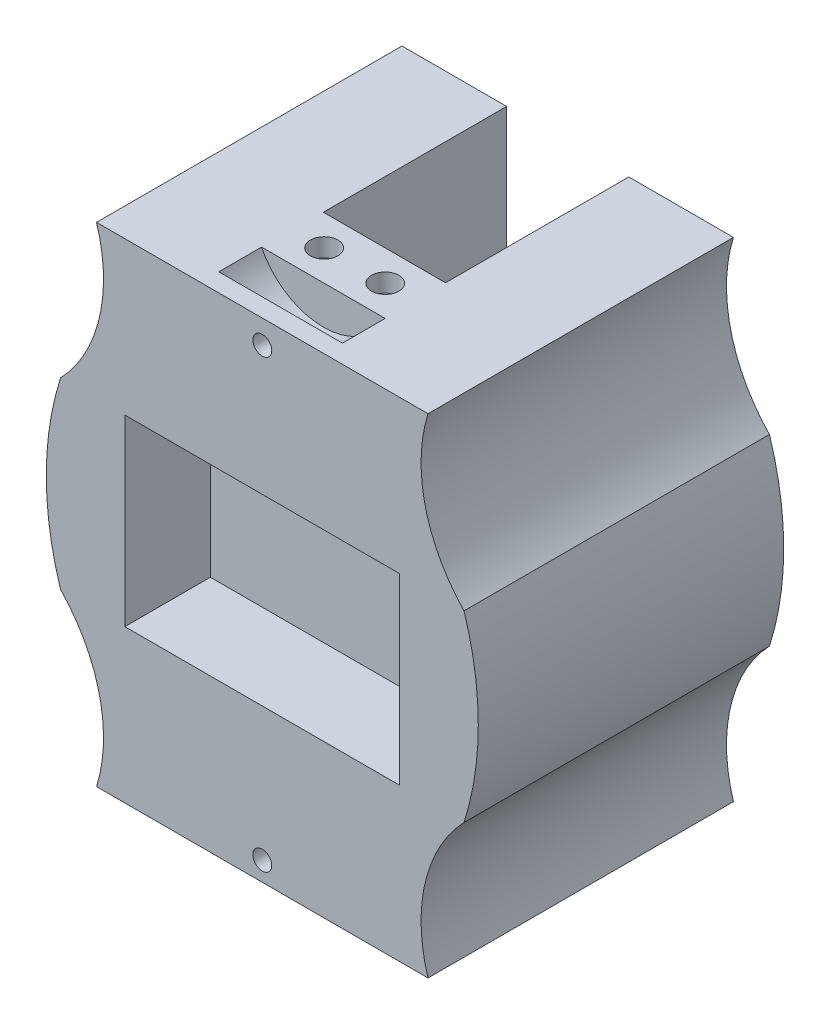
from build123d import *

# Parameters (mm, degrees)
SKETCH_1_W                = 65
SKETCH_1_H                = 25
SKETCH_1_W_2              = 17.5
SKETCH_1_H_2              = 30
EXTRUDE_1_DEPTH           = 30
SKETCH_2_W                = 37.5
SKETCH_2_H                = 30
EXTRUDE_2_DEPTH           = 10
CUT_EXTRUDE_2_DEPTH       = 10
SKETCH_4_W                = 45
SKETCH_4_H                = 30
CUT_EXTRUDE_3_DEPTH       = 6
CUT_EXTRUDE_13_DEPTH      = 16
EXTRUDE_3_DEPTH           = 3
CUT_EXTRUDE_14_DEPTH      = 3
SKETCH_8_R                = 1.55
CUT_EXTRUDE_16_DEPTH      = 6.100799321
CUT_EXTRUDE_17_DEPTH      = 70
EXTRUDE_4_DEPTH           = 20
SKETCH_19_W               = 20
SKETCH_19_H               = 60
CUT_EXTRUDE_25_DEPTH      = 26.5
SKETCH_21_R               = 2.25
CUT_EXTRUDE_27_DEPTH      = 3
SKETCH_22_R               = 2.25
CUT_EXTRUDE_28_DEPTH      = 3
SKETCH_23_W               = 20
SKETCH_23_H               = 26.5
CUT_EXTRUDE_29_DEPTH      = 30
CUT_EXTRUDE_START         = -3
SKETCH_24_R               = 2.25
CUT_EXTRUDE_30_DEPTH      = 3
SKETCH_25_R               = 2
EXTRUDE_5_DEPTH           = 6
SKETCH_26_W               = 45
SKETCH_26_H               = 30
CUT_EXTRUDE_31_DEPTH      = 8
CUT_EXTRUDE_33_DEPTH      = 13
CUT_EXTRUDE_33_DEPTH_BACK = 13
SKETCH_27_R               = 2


with BuildPart() as part:
    # 草图1 → 凸台-拉伸1 (new body)
    with BuildSketch(Plane.XY):
        with Locations((0, 27.5)):
            Rectangle(SKETCH_1_W, SKETCH_1_H)
        with BuildLine():
            ThreePointArc((-41.25, 40), (-40.44733047, 25.687815665), (-50, 15))
            Line((-50, 15), (-32.5, 15))
            Line((-32.5, 15), (-32.5, 40))
            Line((-32.5, 40), (-41.25, 40))
        make_face()
        with BuildLine():
            Line((32.5, 40), (32.5, 15))
            Line((32.5, 15), (50, 15))
            ThreePointArc((50, 15), (40.44733047, 25.687815665), (41.25, 40))
            Line((41.25, 40), (32.5, 40))
        make_face()
        with Locations((41.25, 0)):
            Rectangle(SKETCH_1_W_2, SKETCH_1_H_2)
        Rectangle(SKETCH_1_W, SKETCH_1_H_2)
        with Locations((-41.25, 0)):
            Rectangle(SKETCH_1_W_2, SKETCH_1_H_2)
        with BuildLine():
            ThreePointArc((-50, -15), (-40.44733047, -25.687815665), (-41.25, -40))
            Line((-41.25, -40), (-32.5, -40))
            Line((-32.5, -40), (-32.5, -15))
            Line((-32.5, -15), (-50, -15))
        make_face()
        with Locations((0, -27.5)):
            Rectangle(SKETCH_1_W, SKETCH_1_H)
        with BuildLine():
            Line((32.5, -15), (32.5, -40))
            Line((32.5, -40), (41.25, -40))
            ThreePointArc((41.25, -40), (40.44733047, -25.687815665), (50, -15))
            Line((50, -15), (32.5, -15))
        make_face()
    extrude(amount=EXTRUDE_1_DEPTH)

    # 草图2 → 凸台-拉伸2 (add)
    with BuildSketch(Plane.XY.offset(30)):
        with Locations((68.75, 0)):
            Rectangle(SKETCH_2_W, SKETCH_2_H)
        with BuildLine():
            ThreePointArc((31.362634986, 83.717731106), (24.230066028, 60.16346689), (10.119378388, 40))
            Line((10.119378388, 40), (41.25, 40))
            Line((41.25, 40), (56.546841385, 71.480257998))
            Line((56.546841385, 71.480257998), (31.362634986, 83.717731106))
        make_face()
        with BuildLine():
            Line((-56.546841385, 71.480257998), (-41.25, 40))
            Line((-41.25, 40), (-10.119378388, 40))
            ThreePointArc((-10.119378388, 40), (-24.230066028, 60.16346689), (-31.362634986, 83.717731106))
            Line((-31.362634986, 83.717731106), (-56.546841385, 71.480257998))
        make_face()
        with Locations((-68.75, 0)):
            Rectangle(SKETCH_2_W, SKETCH_2_H)
        with BuildLine():
            ThreePointArc((-31.362634986, -83.717731106), (-24.230066028, -60.16346689), (-10.119378388, -40))
            Line((-10.119378388, -40), (-41.25, -40))
            Line((-41.25, -40), (-56.546841385, -71.480257998))
            Line((-56.546841385, -71.480257998), (-31.362634986, -83.717731106))
        make_face()
        with BuildLine():
            Line((41.25, -40), (10.119378388, -40))
            ThreePointArc((10.119378388, -40), (24.230066028, -60.16346689), (31.362634986, -83.717731106))
            Line((31.362634986, -83.717731106), (56.546841385, -71.480257998))
            Line((56.546841385, -71.480257998), (41.25, -40))
        make_face()
    extrude(amount=-EXTRUDE_2_DEPTH)

    # 草图3 → 切除-拉伸2 (cut)
    with BuildSketch(Plane.XY.offset(30)):
        with BuildLine():
            ThreePointArc((-30.119378388, 40), (-30.215276688, 27.042312386), (-35, 15))
            Line((-35, 15), (-50, 15))
            ThreePointArc((-50, 15), (-40.44733047, 25.687815665), (-41.25, 40))
            Line((-41.25, 40), (-56.546841385, 71.480257998))
            Line((-56.546841385, 71.480257998), (-31.362634986, 83.717731106))
            ThreePointArc((-31.362634986, 83.717731106), (-24.230066028, 60.16346689), (-10.119378388, 40))
            Line((-10.119378388, 40), (-30.119378388, 40))
        make_face()
        with BuildLine():
            Line((10.119378388, 40), (30.119378388, 40))
            ThreePointArc((30.119378388, 40), (30.215276688, 27.042312386), (35, 15))
            Line((35, 15), (50, 15))
            ThreePointArc((50, 15), (40.44733047, 25.687815665), (41.25, 40))
            Line((41.25, 40), (56.546841385, 71.480257998))
            Line((56.546841385, 71.480257998), (31.362634986, 83.717731106))
            ThreePointArc((31.362634986, 83.717731106), (24.230066028, 60.16346689), (10.119378388, 40))
        make_face()
        with BuildLine():
            Line((50, 15), (35, 15))
            ThreePointArc((35, 15), (38.436125858, 0), (35, -15))
            ThreePointArc((35, -15), (30.215276688, -27.042312386), (30.119378388, -40))
            Line((30.119378388, -40), (10.119378388, -40))
            ThreePointArc((10.119378388, -40), (24.230066028, -60.16346689), (31.362634986, -83.717731106))
            Line((31.362634986, -83.717731106), (56.546841385, -71.480257998))
            Line((56.546841385, -71.480257998), (41.25, -40))
            ThreePointArc((41.25, -40), (40.44733047, -25.687815665), (50, -15))
            Line((50, -15), (87.5, -15))
            Line((87.5, -15), (87.5, 15))
            Line((87.5, 15), (50, 15))
        make_face()
        with BuildLine():
            ThreePointArc((-35, 15), (-38.436125858, 0), (-35, -15))
            ThreePointArc((-35, -15), (-30.215276688, -27.042312386), (-30.119378388, -40))
            Line((-30.119378388, -40), (-10.119378388, -40))
            ThreePointArc((-10.119378388, -40), (-24.230066028, -60.16346689), (-31.362634986, -83.717731106))
            Line((-31.362634986, -83.717731106), (-56.546841385, -71.480257998))
            Line((-56.546841385, -71.480257998), (-41.25, -40))
            ThreePointArc((-41.25, -40), (-40.44733047, -25.687815665), (-50, -15))
            Line((-50, -15), (-87.5, -15))
            Line((-87.5, -15), (-87.5, 15))
            Line((-87.5, 15), (-50, 15))
            Line((-50, 15), (-35, 15))
        make_face()
        with BuildLine():
            ThreePointArc((-10.119378388, 40), (0, 33.708220629), (10.119378388, 40))
            Line((10.119378388, 40), (-10.119378388, 40))
        make_face()
        with BuildLine():
            ThreePointArc((-10.119378388, -40), (0, -33.708220629), (10.119378388, -40))
            Line((10.119378388, -40), (-10.119378388, -40))
        make_face()
    extrude(amount=-CUT_EXTRUDE_2_DEPTH, mode=Mode.SUBTRACT)

    # 草图4 → 切除-拉伸3 (cut)
    with BuildSketch(Plane.XY.offset(30)):
        Rectangle(SKETCH_4_W, SKETCH_4_H)
    extrude(amount=-CUT_EXTRUDE_3_DEPTH, mode=Mode.SUBTRACT)

    # 草图5 → 切除-拉伸13 (cut)
    with BuildSketch(Plane.XY.offset(30)):
        with BuildLine():
            ThreePointArc((-30.119378388, 40), (-30.215276688, 27.042312386), (-35, 15))
            ThreePointArc((-35, 15), (-38.436125858, 0), (-35, -15))
            ThreePointArc((-35, -15), (-30.215276688, -27.042312386), (-30.119378388, -40))
            Line((-30.119378388, -40), (-27.133662439, -40))
            ThreePointArc((-27.133662439, -40), (-26.666769997, -26.695264692), (-33.027175168, -15))
            ThreePointArc((-33.027175168, -15), (-35.361355844, 0), (-33.027175168, 15))
            ThreePointArc((-33.027175168, 15), (-26.666769997, 26.695264692), (-27.133662439, 40))
            Line((-27.133662439, 40), (-30.119378388, 40))
        make_face()
        with BuildLine():
            Line((30.119378388, 40), (27.133662439, 40))
            ThreePointArc((27.133662439, 40), (26.666769997, 26.695264692), (33.027175168, 15))
            ThreePointArc((33.027175168, 15), (35.361355844, 0), (33.027175168, -15))
            ThreePointArc((33.027175168, -15), (26.666769997, -26.695264692), (27.133662439, -40))
            Line((27.133662439, -40), (30.119378388, -40))
            ThreePointArc((30.119378388, -40), (30.215276688, -27.042312386), (35, -15))
            ThreePointArc((35, -15), (38.436125858, 0), (35, 15))
            ThreePointArc((35, 15), (30.215276688, 27.042312386), (30.119378388, 40))
        make_face()
    extrude(amount=-CUT_EXTRUDE_13_DEPTH, mode=Mode.SUBTRACT)

    # 草图6 → 凸台-拉伸3 (add)
    with BuildSketch(Plane.XY.offset(30)):
        with BuildLine():
            Line((-10.119378388, 40), (10.119378388, 40))
            ThreePointArc((10.119378388, 40), (0, 33.708220629), (-10.119378388, 40))
        make_face()
        with BuildLine():
            Line((-10.119378388, -40), (10.119378388, -40))
            ThreePointArc((10.119378388, -40), (0, -33.708220629), (-10.119378388, -40))
        make_face()
    extrude(amount=-EXTRUDE_3_DEPTH)

    # 草图7 → 切除-拉伸14 (cut)
    with BuildSketch(Plane(origin=(0, 0, 27), x_dir=(-1, 0, 0), z_dir=(0, 0, -1))):
        with BuildLine():
            ThreePointArc((0, -35.304110315), (-1.55, -36.854110315), (0, -38.404110315))
            Line((0, -38.404110315), (0, -36.854110315))
            Line((0, -36.854110315), (0, -35.304110315))
        make_face()
        with BuildLine():
            Line((0, -36.854110315), (0, -38.404110315))
            ThreePointArc((0, -38.404110315), (1.096015511, -37.950125825), (1.55, -36.854110315))
            ThreePointArc((1.55, -36.854110315), (1.096015511, -35.758094804), (0, -35.304110315))
            Line((0, -35.304110315), (0, -36.854110315))
        make_face()
    extrude(amount=-CUT_EXTRUDE_14_DEPTH, mode=Mode.SUBTRACT)

    # 草图8 → 切除-拉伸16 (cut)
    with BuildSketch(Plane(origin=(0, 0, 27), x_dir=(-1, 0, 0), z_dir=(0, 0, -1))):
        with Locations((0, 36.145889685)):
            Circle(SKETCH_8_R)
    extrude(amount=-CUT_EXTRUDE_16_DEPTH, mode=Mode.SUBTRACT)

    # 草图10 → 切除-拉伸17 (cut)
    with BuildSketch(Plane.XY.offset(30)):
        Polygon((-155.646447014, 80.863193175), (70.83129327, 55.935441896), (148.654516777, 0), (148.654516777, -24.319757346), (1.823981801, -88.159120379), (-119.470807962, -24.319757346), align=None)
        with BuildLine():
            Line((-27.133662439, 40), (27.133662439, 40))
            ThreePointArc((27.133662439, 40), (26.666769997, 26.695264692), (33.027175168, 15))
            ThreePointArc((33.027175168, 15), (35.361355844, 0), (33.027175168, -15))
            ThreePointArc((33.027175168, -15), (26.666769997, -26.695264692), (27.133662439, -40))
            Line((27.133662439, -40), (-27.133662439, -40))
            ThreePointArc((-27.133662439, -40), (-26.666769997, -26.695264692), (-33.027175168, -15))
            ThreePointArc((-33.027175168, -15), (-35.361355844, 0), (-33.027175168, 15))
            ThreePointArc((-33.027175168, 15), (-26.666769997, 26.695264692), (-27.133662439, 40))
        make_face(mode=Mode.SUBTRACT)
    extrude(amount=-CUT_EXTRUDE_17_DEPTH, mode=Mode.SUBTRACT)

    # 草图11 → 凸台-拉伸4 (add)
    with BuildSketch(Plane(origin=(0, 0, 0), x_dir=(-1, 0, 0), z_dir=(0, 0, -1))):
        with BuildLine():
            Line((-27.133662439, 40), (27.133662439, 40))
            ThreePointArc((27.133662439, 40), (26.666769997, 26.695264692), (33.027175168, 15))
            ThreePointArc((33.027175168, 15), (35.361355844, 0), (33.027175168, -15))
            ThreePointArc((33.027175168, -15), (26.666769997, -26.695264692), (27.133662439, -40))
            Line((27.133662439, -40), (-27.133662439, -40))
            ThreePointArc((-27.133662439, -40), (-26.666769997, -26.695264692), (-33.027175168, -15))
            ThreePointArc((-33.027175168, -15), (-35.361355844, 0), (-33.027175168, 15))
            ThreePointArc((-33.027175168, 15), (-26.666769997, 26.695264692), (-27.133662439, 40))
        make_face()
    extrude(amount=EXTRUDE_4_DEPTH)

    # 草图19 → 切除-拉伸25 (cut)
    with BuildSketch(Plane(origin=(0, 40, 0), x_dir=(1, 0, 0), z_dir=(0, 1, 0))):
        with Locations((0, 20)):
            Rectangle(SKETCH_19_W, SKETCH_19_H)
    extrude(amount=-CUT_EXTRUDE_25_DEPTH, mode=Mode.SUBTRACT)

    # 草图21 → 切除-拉伸27 (cut)
    with BuildSketch(Plane(origin=(0, 40, 0), x_dir=(1, 0, 0), z_dir=(0, 1, 0))):
        with Locations(Location((-4.875, -15, 0), (0, 0, 270))):
            Circle(SKETCH_21_R)
    extrude(amount=-CUT_EXTRUDE_27_DEPTH, mode=Mode.SUBTRACT)

    # 草图22 → 切除-拉伸28 (cut)
    with BuildSketch(Plane(origin=(0, 40, 0), x_dir=(1, 0, 0), z_dir=(0, 1, 0))):
        with Locations(Location((5.125, -15, 0), (0, 0, 270))):
            Circle(SKETCH_22_R)
    extrude(amount=-CUT_EXTRUDE_28_DEPTH, mode=Mode.SUBTRACT)

    # 草图23 → 切除-拉伸29 (cut)
    with BuildSketch(Plane(origin=(0, 0, -20), x_dir=(-1, 0, 0), z_dir=(0, 0, -1))):
        with Locations((0, -26.75)):
            Rectangle(SKETCH_23_W, SKETCH_23_H)
        with Locations((0, 26.75)):
            Rectangle(SKETCH_23_W, SKETCH_23_H)
    extrude(amount=-CUT_EXTRUDE_29_DEPTH, mode=Mode.SUBTRACT)

    # 草图24 → 切除-拉伸30 (cut)
    with BuildSketch(Plane.XZ.offset(40).offset(CUT_EXTRUDE_START)):
        with Locations(Location((-4.875, 15, 0), (0, 0, 90))):
            Circle(SKETCH_24_R)
        with Locations(Location((5.125, 15, 0), (0, 0, 90))):
            Circle(SKETCH_24_R)
    extrude(amount=CUT_EXTRUDE_30_DEPTH, mode=Mode.SUBTRACT)

    # 草图25 → 凸台-拉伸5 (add)
    with BuildSketch(Plane(origin=(0, 0, -20), x_dir=(-1, 0, 0), z_dir=(0, 0, -1))):
        with Locations((-28.221169036, 10.01790416)):
            Circle(SKETCH_25_R)
        with Locations((-28.221169036, -3.298578199)):
            Circle(SKETCH_25_R)
    extrude(amount=EXTRUDE_5_DEPTH)

    # 草图26 → 切除-拉伸31 (cut)
    with BuildSketch(Plane.XY.offset(24)):
        Rectangle(SKETCH_26_W, SKETCH_26_H)
    extrude(amount=-CUT_EXTRUDE_31_DEPTH, mode=Mode.SUBTRACT)

    # 草图27 → 切除-拉伸33 (cut, two sides: drawn at the far end of the back side and taken through both)
    with BuildSketch(Plane(origin=(0, 0, -20), x_dir=(-1, 0, 0), z_dir=(0, 0, -1)).offset(-CUT_EXTRUDE_33_DEPTH_BACK)):
        with Locations((-28.221169036, -3.298578199)):
            Circle(SKETCH_27_R)
        with Locations((-28.221169036, 10.01790416)):
            Circle(SKETCH_27_R)
    extrude(amount=CUT_EXTRUDE_33_DEPTH + CUT_EXTRUDE_33_DEPTH_BACK, mode=Mode.SUBTRACT)


solid = part.part
